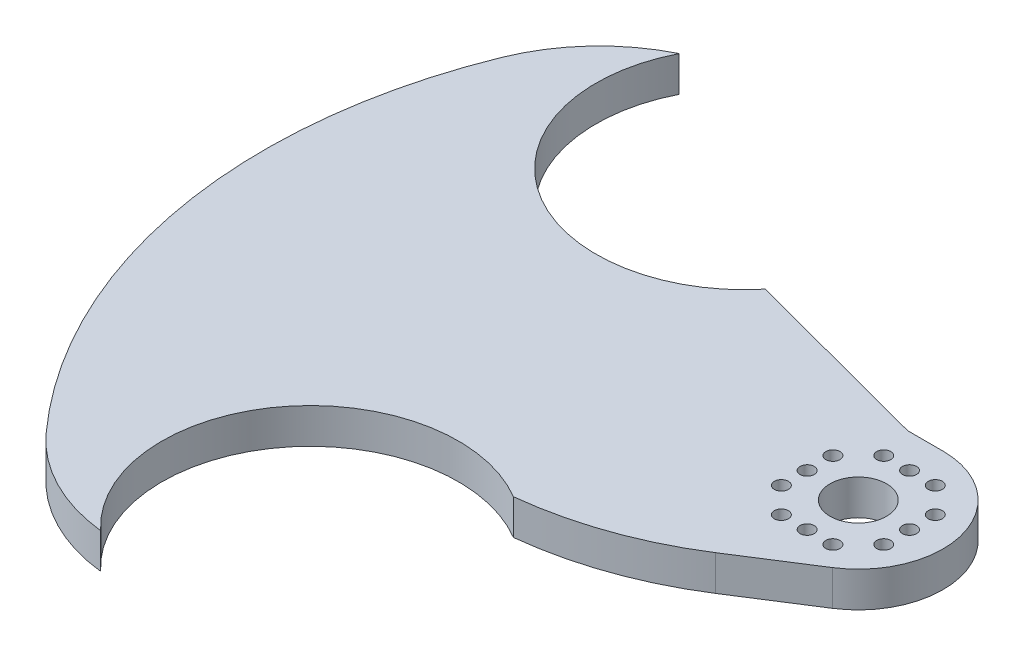
from build123d import *

# Parameters (mm, degrees)
ESQUISSE1_R        = 4
ESQUISSE1_R_2      = 1
BOSS_EXTRU_1_DEPTH = 5


with BuildPart() as part:
    # Esquisse1 → Boss.-Extru.1 (new body)
    with BuildSketch(Plane(origin=(0, 0, 0), x_dir=(1, 0, 0), z_dir=(0, 1, 0))):
        with BuildLine():
            Line((-32.45676656, 19.27541283), (-5, 12))
            Line((-5, 12), (0, 12))
            ThreePointArc((0, 12), (11.519722281, 3.360952031), (6.452872334, -10.117333574))
            Line((6.452872334, -10.117333574), (-3.66446124, -16.570205908))
            ThreePointArc((-3.66446124, -16.570205908), (-13.815132068, -21.511376537), (-24.82365287, -24.014126066))
            ThreePointArc((-24.82365287, -24.014126066), (-52.345095334, -29.457799684), (-49.895398662, -57.405292665))
            ThreePointArc((-49.895398662, -57.405292665), (-58.555043799, -54.803988162), (-65.722985518, -49.292468357))
            ThreePointArc((-65.722985518, -49.292468357), (-83.868971565, -12.107677443), (-79.535269898, 29.040888933))
            ThreePointArc((-79.535269898, 29.040888933), (-74.684658752, 36.671603877), (-67.436952657, 42.077803594))
            ThreePointArc((-67.436952657, 42.077803594), (-60.180308988, 14.977905063), (-32.45676656, 19.27541283))
        make_face()
        with Locations(Location((0, 0, 0), (0, 0, 270))):
            Circle(ESQUISSE1_R, mode=Mode.SUBTRACT)
        with Locations(Location((7.25, -3.65, 0), (0, 0, 270))):
            Circle(ESQUISSE1_R_2, mode=Mode.SUBTRACT)
        with Locations(Location((7.25, 0, 0), (0, 0, 270))):
            Circle(ESQUISSE1_R_2, mode=Mode.SUBTRACT)
        with Locations(Location((7.25, 3.65, 0), (0, 0, 270))):
            Circle(ESQUISSE1_R_2, mode=Mode.SUBTRACT)
        with Locations(Location((3.65, -7.25, 0), (0, 0, 270))):
            Circle(ESQUISSE1_R_2, mode=Mode.SUBTRACT)
        with Locations(Location((0, -7.25, 0), (0, 0, 270))):
            Circle(ESQUISSE1_R_2, mode=Mode.SUBTRACT)
        with Locations(Location((-3.65, -7.25, 0), (0, 0, 270))):
            Circle(ESQUISSE1_R_2, mode=Mode.SUBTRACT)
        with Locations(Location((-7.25, -3.65, 0), (0, 0, 270))):
            Circle(ESQUISSE1_R_2, mode=Mode.SUBTRACT)
        with Locations(Location((-7.25, 0, 0), (0, 0, 270))):
            Circle(ESQUISSE1_R_2, mode=Mode.SUBTRACT)
        with Locations(Location((-7.25, 3.65, 0), (0, 0, 270))):
            Circle(ESQUISSE1_R_2, mode=Mode.SUBTRACT)
        with Locations(Location((-3.65, 7.25, 0), (0, 0, 270))):
            Circle(ESQUISSE1_R_2, mode=Mode.SUBTRACT)
        with Locations(Location((0, 7.25, 0), (0, 0, 270))):
            Circle(ESQUISSE1_R_2, mode=Mode.SUBTRACT)
        with Locations(Location((3.65, 7.25, 0), (0, 0, 270))):
            Circle(ESQUISSE1_R_2, mode=Mode.SUBTRACT)
    extrude(amount=BOSS_EXTRU_1_DEPTH)


solid = part.part
